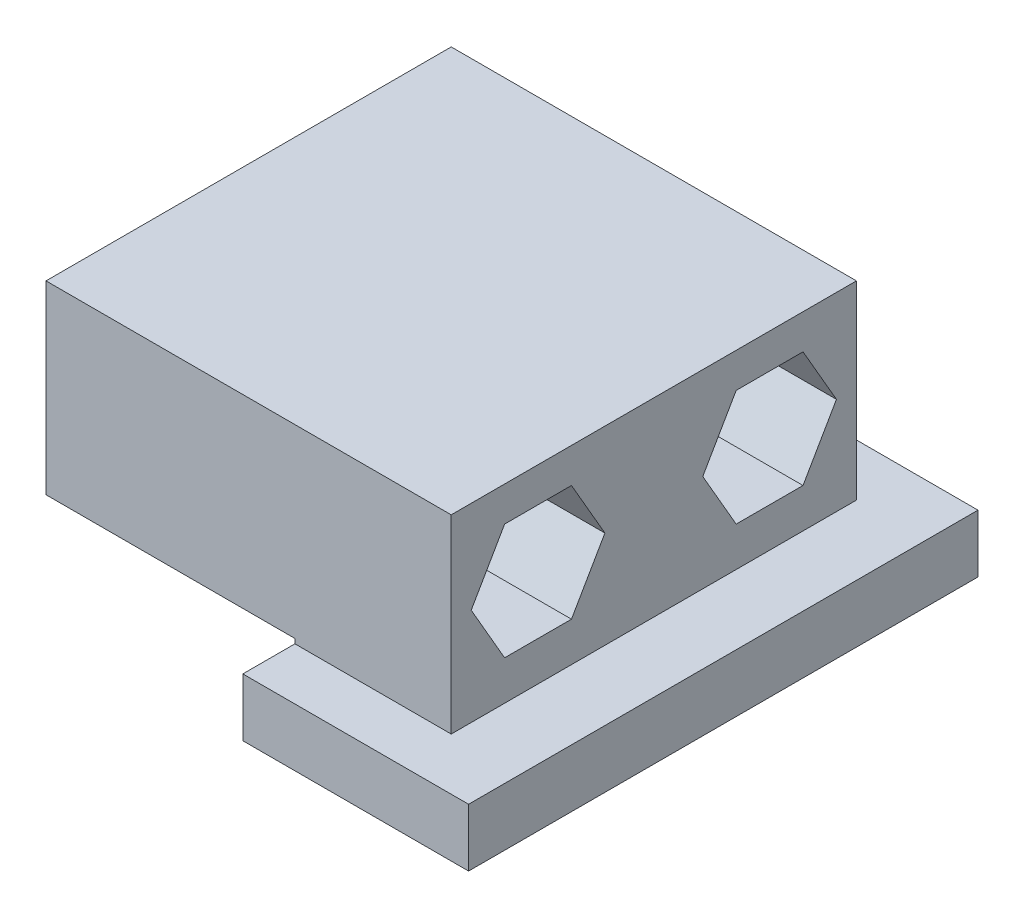
from build123d import *

# Parameters (mm, degrees)
SKETCH_1_W          = 17.5
SKETCH_1_H          = 17.5
EXTRUDE_1_DEPTH     = 8
SKETCH_2_R          = 1.35
CUT_EXTRUDE_1_DEPTH = 22.137939824
CUT_EXTRUDE_2_DEPTH = 4
SKETCH_5_W          = 6.75
SKETCH_5_H          = 17.5
EXTRUDE_3_DEPTH     = 0.2
SKETCH_6_W          = 9.75
SKETCH_6_H          = 22
EXTRUDE_4_DEPTH     = 2.5


with BuildPart() as part:
    # 草图1 → 凸台-拉伸1 (new body)
    with BuildSketch(Plane(origin=(0, 0, 0), x_dir=(1, 0, 0), z_dir=(0, 1, 0))):
        Rectangle(SKETCH_1_W, SKETCH_1_H)
    extrude(amount=EXTRUDE_1_DEPTH)

    # 草图2 → 切除-拉伸1 (cut, through all)
    with BuildSketch(Plane(origin=(8.75, 0, 0), x_dir=(0, 0, -1), z_dir=(1, 0, 0))):
        with Locations((5, 4)):
            Circle(SKETCH_2_R)
        with Locations(Location((-5, 4, 0), (0, 0, 180))):
            Circle(SKETCH_2_R)
    extrude(amount=-CUT_EXTRUDE_1_DEPTH, mode=Mode.SUBTRACT)

    # 草图3 → 切除-拉伸2 (cut)
    with BuildSketch(Plane(origin=(8.75, 0, 0), x_dir=(0, 0, -1), z_dir=(1, 0, 0))):
        Polygon((7.886751346, 4), (6.443375673, 6.5), (3.556624327, 6.5), (2.113248654, 4), (3.556624327, 1.5), (6.443375673, 1.5), align=None)
        Polygon((-6.443375673, 1.5), (-7.886751346, 4), (-6.443375673, 6.5), (-3.556624327, 6.5), (-2.113248654, 4), (-3.556624327, 1.5), align=None)
    extrude(amount=-CUT_EXTRUDE_2_DEPTH, mode=Mode.SUBTRACT)

    # 草图5 → 凸台-拉伸3 (add)
    with BuildSketch(Plane.XZ):
        with Locations((5.375, 0)):
            Rectangle(SKETCH_5_W, SKETCH_5_H)
    extrude(amount=EXTRUDE_3_DEPTH)

    # 草图6 → 凸台-拉伸4 (add)
    with BuildSketch(Plane.XZ.offset(0.2)):
        with Locations((6.875, 0)):
            Rectangle(SKETCH_6_W, SKETCH_6_H)
    extrude(amount=EXTRUDE_4_DEPTH)


solid = part.part
